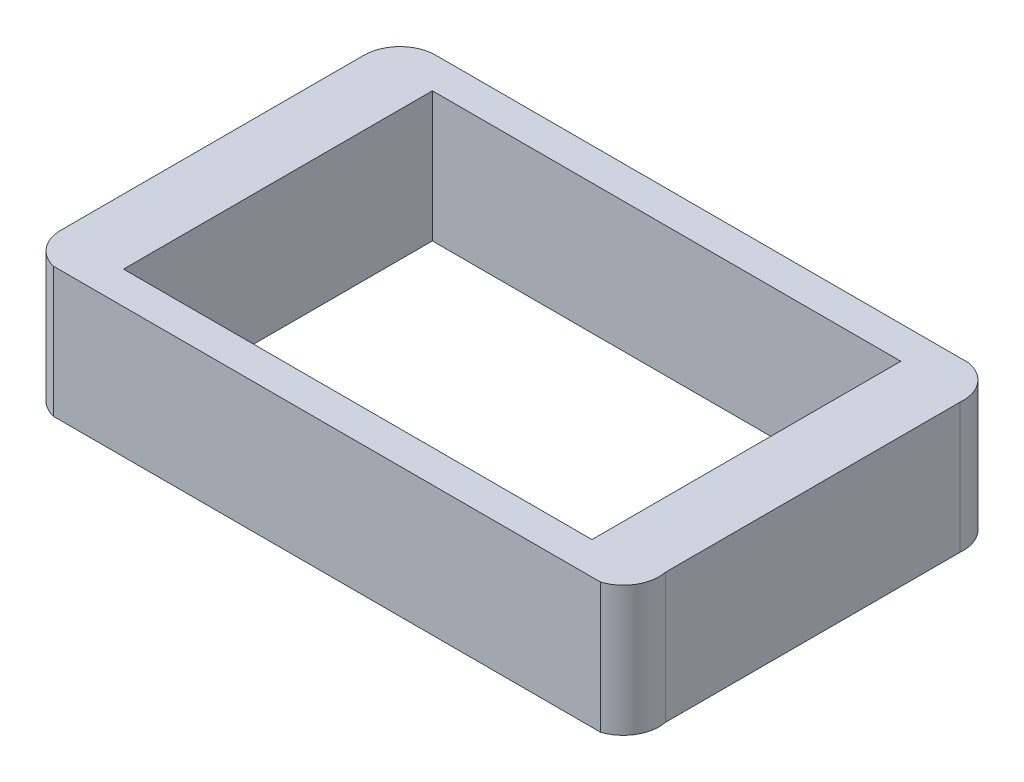
from build123d import *

# Parameters (mm, degrees)
SKETCH1_W           = 144.077216911
SKETCH1_H           = 95
BOSS_EXTRUDE1_DEPTH = 40
SKETCH1_2_W         = 144.077216911
SKETCH1_2_H         = 95
BOSS_EXTRUDE2_DEPTH = 40


with BuildPart() as part:
    # Sketch1 → Boss-Extrude1 (new body)
    with BuildSketch(Plane(origin=(0, 0, 0), x_dir=(1, 0, 0), z_dir=(0, 1, 0))):
        with BuildLine():
            Line((82.709021157, -55.64828922), (-85.557066869, -55.64828922))
            ThreePointArc((-85.557066869, -55.64828922), (-91.537525449, -51.905150215), (-94.013859445, -45.298733306))
            Line((-94.013859445, -45.298733306), (-94.013859445, 48.380180377))
            ThreePointArc((-94.013859445, 48.380180377), (-90.771939739, 56.150001197), (-82.985463341, 59.35171078))
            Line((-82.985463341, 59.35171078), (80.864804877, 59.35171078))
            ThreePointArc((80.864804877, 59.35171078), (87.782044869, 55.253574592), (90.063357466, 47.543935031))
            Line((90.063357466, 47.543935031), (90.063357466, -43.073295521))
            ThreePointArc((90.063357466, -43.073295521), (88.766131999, -50.752673698), (82.709021157, -55.64828922))
        make_face()
        with Locations((-1.97525099, 1.85171078)):
            Rectangle(SKETCH1_W, SKETCH1_H, mode=Mode.SUBTRACT)
    extrude(amount=BOSS_EXTRUDE1_DEPTH)

    # Sketch1<2> → Boss-Extrude2 (add)
    with BuildSketch(Plane(origin=(0, 0, 0), x_dir=(1, 0, 0), z_dir=(0, 1, 0))):
        with BuildLine():
            Line((82.709021157, -55.64828922), (-85.557066869, -55.64828922))
            ThreePointArc((-85.557066869, -55.64828922), (-91.537525449, -51.905150215), (-94.013859445, -45.298733306))
            Line((-94.013859445, -45.298733306), (-94.013859445, 48.380180377))
            ThreePointArc((-94.013859445, 48.380180377), (-90.771939739, 56.150001197), (-82.985463341, 59.35171078))
            Line((-82.985463341, 59.35171078), (80.864804877, 59.35171078))
            ThreePointArc((80.864804877, 59.35171078), (87.782044869, 55.253574592), (90.063357466, 47.543935031))
            Line((90.063357466, 47.543935031), (90.063357466, -43.073295521))
            ThreePointArc((90.063357466, -43.073295521), (88.766131999, -50.752673698), (82.709021157, -55.64828922))
        make_face()
        with Locations((-1.97525099, 1.85171078)):
            Rectangle(SKETCH1_2_W, SKETCH1_2_H, mode=Mode.SUBTRACT)
    extrude(amount=BOSS_EXTRUDE2_DEPTH)


solid = part.part
